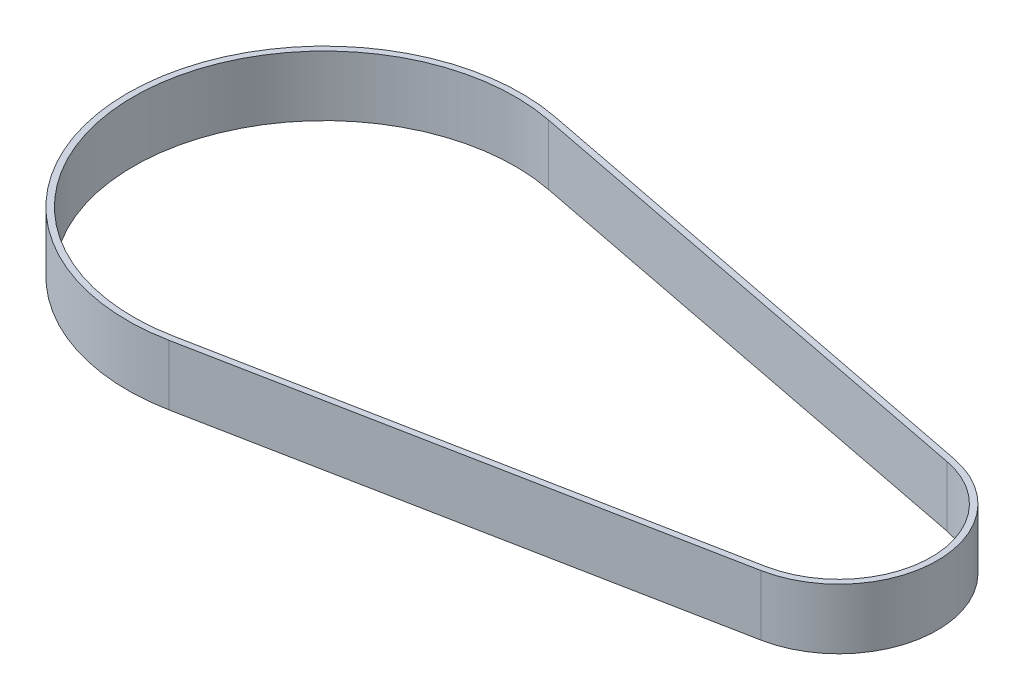
from build123d import *

# Parameters (mm, degrees)
EXTRUDE_1_DEPTH = 15


with BuildPart() as part:
    # 草图1 → 凸台-拉伸1 (new body)
    with BuildSketch(Plane(origin=(0, 0, 0), x_dir=(1, 0, 0), z_dir=(0, 1, 0))):
        with BuildLine():
            Line((9.37890625, -48.094034116), (132.689453125, -24.047017058))
            ThreePointArc((132.689453125, -24.047017058), (152.5, 0), (132.689453125, 24.047017058))
            Line((132.689453125, 24.047017058), (9.37890625, 48.094034116))
            ThreePointArc((9.37890625, 48.094034116), (-49, 0), (9.37890625, -48.094034116))
        make_face()
        with BuildLine():
            Line((9.091796875, 46.621767766), (132.40234375, 22.574750708))
            ThreePointArc((132.40234375, 22.574750708), (151, 0), (132.40234375, -22.574750708))
            Line((132.40234375, -22.574750708), (9.091796875, -46.621767766))
            ThreePointArc((9.091796875, -46.621767766), (-47.5, 0), (9.091796875, 46.621767766))
        make_face(mode=Mode.SUBTRACT)
    extrude(amount=EXTRUDE_1_DEPTH)


solid = part.part
